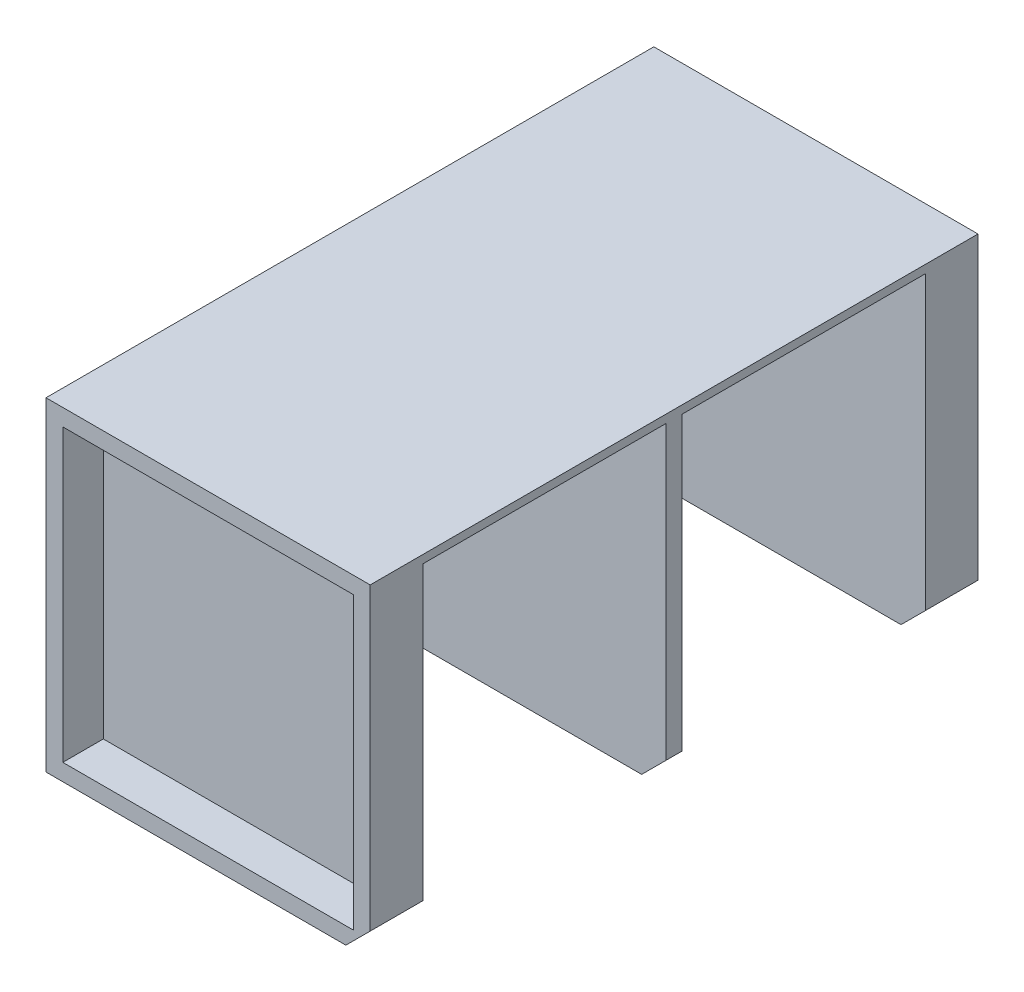
from build123d import *

# Parameters (mm, degrees)
SKETCH1_W                           = 80
SKETCH1_H                           = 80
BOSS_EXTRUDE1_DEPTH                 = 150
SKETCH2_W                           = 71.7
SKETCH2_H                           = 71.7
CUT_EXTRUDE1_71_7SQUARE_DEPTH       = 10
SKETCH4_W                           = 78
SKETCH4_H                           = 78
CUT_EXTRUDE2_COMPARTMENT1_6CM_DEPTH = 60
SKETCH5_W                           = 78
SKETCH5_H                           = 78
CUT_EXTRUDE3_DEPTH                  = 60
SKETCH6_W                           = 71
SKETCH6_H                           = 71
CUT_EXTRUDE4_DEPTH                  = 60
CUT_EXTRUDE4_TAPER                  = 2
CHAMFER1_SIZE                       = 6


with BuildPart() as part:
    # Sketch1 → Boss-Extrude1 (new body)
    with BuildSketch(Plane(origin=(0, 0, 0), x_dir=(0, 1, 0), z_dir=(0, 0, 1))):
        Rectangle(SKETCH1_W, SKETCH1_H)
    extrude(amount=BOSS_EXTRUDE1_DEPTH)

    # Sketch2 → Cut-Extrude1-71.7square (cut)
    with BuildSketch(Plane.XY.offset(150)):
        Rectangle(SKETCH2_W, SKETCH2_H)
    extrude(amount=-CUT_EXTRUDE1_71_7SQUARE_DEPTH, mode=Mode.SUBTRACT)

    # Sketch4 → Cut-Extrude2-compartment1-6cm (cut)
    with BuildSketch(Plane.XY.offset(137)):
        with Locations((1, -1)):
            Rectangle(SKETCH4_W, SKETCH4_H)
    extrude(amount=-CUT_EXTRUDE2_COMPARTMENT1_6CM_DEPTH, mode=Mode.SUBTRACT)

    # Sketch5 → Cut-Extrude3 (cut)
    with BuildSketch(Plane.XY.offset(73)):
        with Locations((1, -1)):
            Rectangle(SKETCH5_W, SKETCH5_H)
    extrude(amount=-CUT_EXTRUDE3_DEPTH, mode=Mode.SUBTRACT)

    # Sketch6 → Cut-Extrude4 (cut)
    with BuildSketch(Plane(origin=(0, 0, 10), x_dir=(1, 0, 0), z_dir=(0, 0, -1))):
        Rectangle(SKETCH6_W, SKETCH6_H)
    extrude(amount=CUT_EXTRUDE4_DEPTH, taper=CUT_EXTRUDE4_TAPER, mode=Mode.SUBTRACT)

    # Chamfer1
    chamfer1_edges = [part.edges().sort_by_distance(p)[0] for p in [
        (40, -40, 75),
        (40, -40, 6.5),
        (40, -40, 143.5),
    ]]
    chamfer(chamfer1_edges, length=CHAMFER1_SIZE)


solid = part.part
